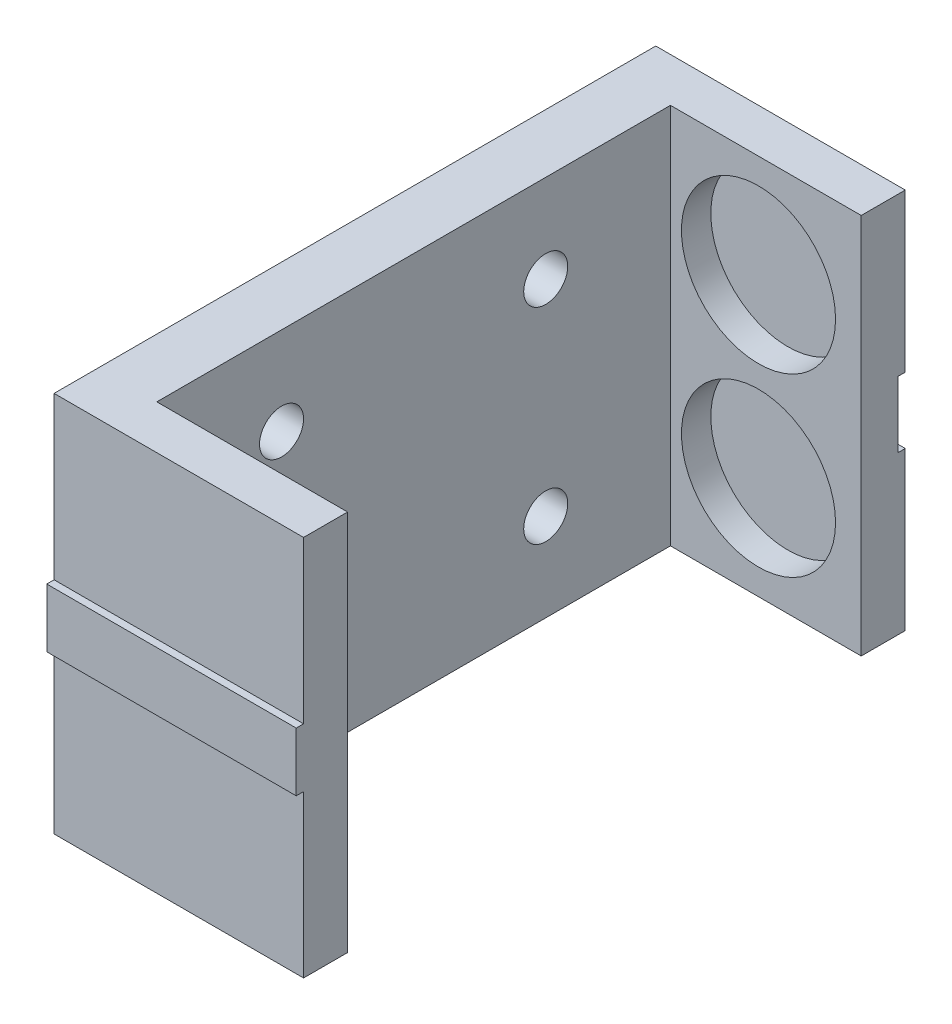
from build123d import *

# Parameters (mm, degrees)
ESQUISSE1_W             = 17
ESQUISSE1_H             = 26
BOSS_EXTRU_1_DEPTH      = 3
ESQUISSE3_W             = 4
ESQUISSE3_H             = 26
BOSS_EXTRU_2_DEPTH      = 38
ESQUISSE4_R             = 1.5
ENL_V_MAT_EXTRU_2_DEPTH = 4
ESQUISSE5_R             = 1.5
ENL_V_MAT_EXTRU_3_DEPTH = 4
ESQUISSE6_W             = 3
ESQUISSE6_H             = 26
BOSS_EXTRU_3_DEPTH      = 13
ESQUISSE8_R             = 5.25
ENL_V_MAT_EXTRU_4_DEPTH = 2
ENL_V_START             = -2
ESQUISSE9_R             = 5.25
ENL_V_MAT_EXTRU_5_DEPTH = 2
ESQUISSE10_W            = 17
ESQUISSE10_H            = 4
BOSS_EXTRU_5_DEPTH      = 0.5
ESQUISSE11_W            = 17
ESQUISSE11_H            = 4.5
ENL_V_MAT_EXTRU_6_DEPTH = 0.5


with BuildPart() as part:
    # Esquisse1 → Boss.-Extru.1 (new body)
    with BuildSketch(Plane.XY):
        with Locations((8.5, 13)):
            Rectangle(ESQUISSE1_W, ESQUISSE1_H)
    extrude(amount=BOSS_EXTRU_1_DEPTH)

    # Esquisse3 → Boss.-Extru.2 (add)
    with BuildSketch(Plane(origin=(0, 0, 0), x_dir=(-1, 0, 0), z_dir=(0, 0, -1))):
        with Locations((-2, 13)):
            Rectangle(ESQUISSE3_W, ESQUISSE3_H)
    extrude(amount=BOSS_EXTRU_2_DEPTH)

    # Esquisse4 → Enlèv. mat.-Extru.2 (cut)
    with BuildSketch(Plane.ZY):
        with Locations((-8.5, 20)):
            Circle(ESQUISSE4_R)
        with Locations((-8.5, 6)):
            Circle(ESQUISSE4_R)
    extrude(amount=-ENL_V_MAT_EXTRU_2_DEPTH, mode=Mode.SUBTRACT)

    # Esquisse5 → Enlèv. mat.-Extru.3 (cut)
    with BuildSketch(Plane.ZY):
        with Locations((-26.5, 19.999545392)):
            Circle(ESQUISSE5_R)
        with Locations((-26.5, 6)):
            Circle(ESQUISSE5_R)
    extrude(amount=-ENL_V_MAT_EXTRU_3_DEPTH, mode=Mode.SUBTRACT)

    # Esquisse6 → Boss.-Extru.3 (add)
    with BuildSketch(Plane(origin=(4, 0, 0), x_dir=(0, 0, -1), z_dir=(1, 0, 0))):
        with Locations((36.5, 13)):
            Rectangle(ESQUISSE6_W, ESQUISSE6_H)
    extrude(amount=BOSS_EXTRU_3_DEPTH)

    # Esquisse8 → Enlèv. mat.-Extru.4 (cut)
    with BuildSketch(Plane(origin=(0, 0, 0), x_dir=(-1, 0, 0), z_dir=(0, 0, -1))):
        with Locations((-10, 7)):
            Circle(ESQUISSE8_R)
        with Locations((-10, 19)):
            Circle(ESQUISSE8_R)
    extrude(amount=-ENL_V_MAT_EXTRU_4_DEPTH, mode=Mode.SUBTRACT)

    # Esquisse9 → Enlèv. mat.-Extru.5 (cut)
    with BuildSketch(Plane.XY.offset(-35).offset(ENL_V_START)):
        with Locations(Location((10, 19, 0), (0, 0, 180))):
            Circle(ESQUISSE9_R)
        with Locations(Location((10, 7, 0), (0, 0, 180))):
            Circle(ESQUISSE9_R)
    extrude(amount=ENL_V_MAT_EXTRU_5_DEPTH, mode=Mode.SUBTRACT)

    # Esquisse10 → Boss.-Extru.5 (add)
    with BuildSketch(Plane.XY.offset(3)):
        with Locations((8.5, 13)):
            Rectangle(ESQUISSE10_W, ESQUISSE10_H)
    extrude(amount=BOSS_EXTRU_5_DEPTH)

    # Esquisse11 → Enlèv. mat.-Extru.6 (cut)
    with BuildSketch(Plane(origin=(0, 0, -38), x_dir=(-1, 0, 0), z_dir=(0, 0, -1))):
        with Locations((-8.5, 13)):
            Rectangle(ESQUISSE11_W, ESQUISSE11_H)
    extrude(amount=-ENL_V_MAT_EXTRU_6_DEPTH, mode=Mode.SUBTRACT)


solid = part.part
